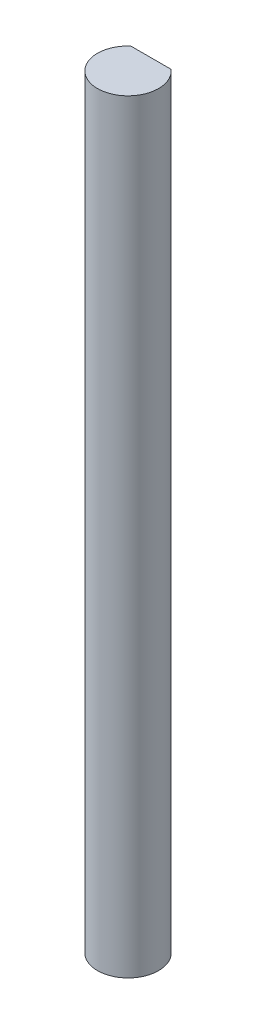
from build123d import *

# Parameters (mm, degrees)
EXTRUDE_1_DEPTH = 100


with BuildPart() as part:
    # 草图1 → 凸台-拉伸1 (new body)
    with BuildSketch(Plane(origin=(0, 0, 0), x_dir=(1, 0, 0), z_dir=(0, 1, 0))):
        with BuildLine():
            ThreePointArc((-2.645751311, 3), (0, -4), (2.645751311, 3))
            Line((2.645751311, 3), (-2.645751311, 3))
        make_face()
    extrude(amount=EXTRUDE_1_DEPTH)


solid = part.part
